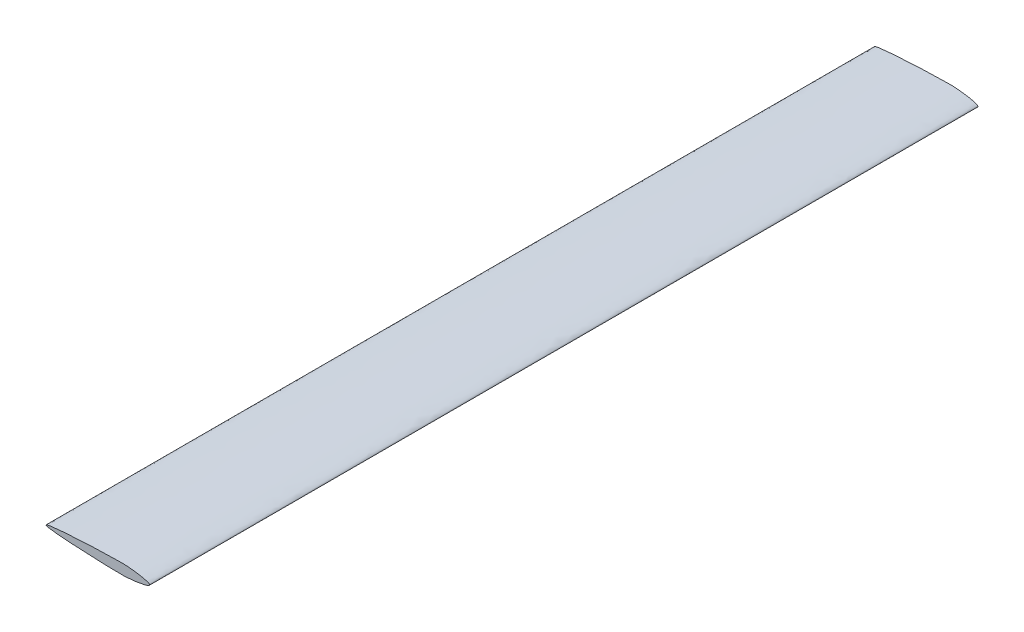
from build123d import *

# Parameters (mm, degrees)
BOSS_EXTRUDE1_DEPTH = 6096


with BuildPart() as part:
    # Sketch2 → Boss-Extrude1 (new body)
    with BuildSketch(Plane.XY):
        with BuildLine():
            add(Edge.make_bspline(
                [(0, 0), (0, 18.316652951), (-141.449231206, 38.884177777), (-384.483659546, 36.565760935), (-1123.174414544, 0), (-384.483659546, -36.565760935), (-141.449231206, -38.884177777), (0, -18.316652951), (0, 0)],
                knots=[0, 0, 0, 0, 0.130248509, 0.14625431, 0.5, 0.85374569, 0.869751491, 1, 1, 1, 1], degree=3))
        make_face()
    extrude(amount=BOSS_EXTRUDE1_DEPTH)


solid = part.part
